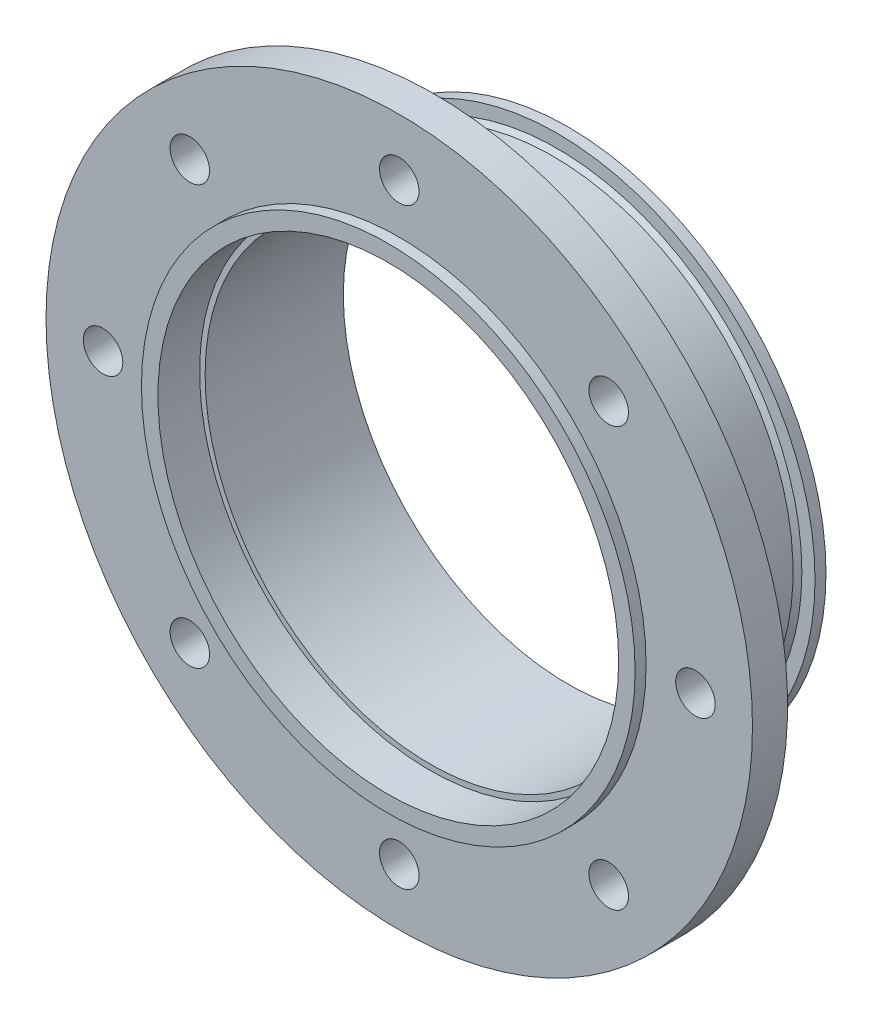
from build123d import *

# Parameters (mm, degrees)
SKETCH1_R           = 161
SKETCH1_R_2         = 102.5
BOSS_EXTRUDE1_DEPTH = 82
SKETCH2_R           = 9
CUT_EXTRUDE1_DEPTH  = 243.004132196
CIRPATTERN1_COUNT   = 8
SKETCH3_R           = 161
SKETCH3_R_2         = 109.5
CUT_EXTRUDE2_DEPTH  = 61
SKETCH4_R           = 117.5
SKETCH4_R_2         = 109.5
BOSS_EXTRUDE3_DEPTH = 5
CUT_EXTRUDE3_START  = -5
SKETCH6_R           = 161
SKETCH6_R_2         = 112.5
CUT_EXTRUDE3_DEPTH  = 5
CHAMFER1_SIZE       = 2
CHAMFER2_SIZE       = 2
SKETCH8_R           = 105
CUT_EXTRUDE5_DEPTH  = 19


with BuildPart() as part:
    # Sketch1 → Boss-Extrude1 (new body)
    with BuildSketch(Plane.XY):
        Circle(SKETCH1_R)
        Circle(SKETCH1_R_2, mode=Mode.SUBTRACT)
    extrude(amount=BOSS_EXTRUDE1_DEPTH)

    # Sketch2 → Cut-Extrude1 (cut, through all)
    with BuildSketch(Plane.XY.offset(82)):
        with Locations((0, 135)):
            Circle(SKETCH2_R)
    cut_extrude1 = extrude(amount=-CUT_EXTRUDE1_DEPTH, mode=Mode.SUBTRACT)

    # CirPattern1: Cut-Extrude1 ×8 about axis
    cirpattern1_axis = Axis((0, 0, 0), (0, 0, 1))
    for i in range(1, CIRPATTERN1_COUNT):
        add(cut_extrude1.rotate(cirpattern1_axis, i * 360 / CIRPATTERN1_COUNT), mode=Mode.SUBTRACT)

    # Sketch3 → Cut-Extrude2 (cut)
    with BuildSketch(Plane(origin=(0, 0, 0), x_dir=(-1, 0, 0), z_dir=(0, 0, -1))):
        Circle(SKETCH3_R)
        Circle(SKETCH3_R_2, mode=Mode.SUBTRACT)
    extrude(amount=-CUT_EXTRUDE2_DEPTH, mode=Mode.SUBTRACT)

    # Sketch4 → Boss-Extrude3 (add)
    with BuildSketch(Plane(origin=(0, 0, 0), x_dir=(-1, 0, 0), z_dir=(0, 0, -1))):
        Circle(SKETCH4_R)
        Circle(SKETCH4_R_2, mode=Mode.SUBTRACT)
    extrude(amount=-BOSS_EXTRUDE3_DEPTH)

    # Sketch6 → Cut-Extrude3 (cut)
    with BuildSketch(Plane.XY.offset(82).offset(CUT_EXTRUDE3_START)):
        with Locations(Location((0, 0, 0), (0, 0, 180))):
            Circle(SKETCH6_R)
        Circle(SKETCH6_R_2, mode=Mode.SUBTRACT)
    extrude(amount=CUT_EXTRUDE3_DEPTH, mode=Mode.SUBTRACT)

    # Chamfer1
    chamfer1_edges = [part.edges().sort_by_distance(p)[0] for p in [
        (109.5, 0, 5),
    ]]
    chamfer(chamfer1_edges, length=CHAMFER1_SIZE)

    # Chamfer2
    chamfer2_edges = [part.edges().sort_by_distance(p)[0] for p in [
        (109.5, 0, 61),
    ]]
    chamfer(chamfer2_edges, length=CHAMFER2_SIZE)

    # Sketch8 → Cut-Extrude5 (cut)
    with BuildSketch(Plane.XY.offset(82)):
        Circle(SKETCH8_R)
    extrude(amount=-CUT_EXTRUDE5_DEPTH, mode=Mode.SUBTRACT)


solid = part.part
